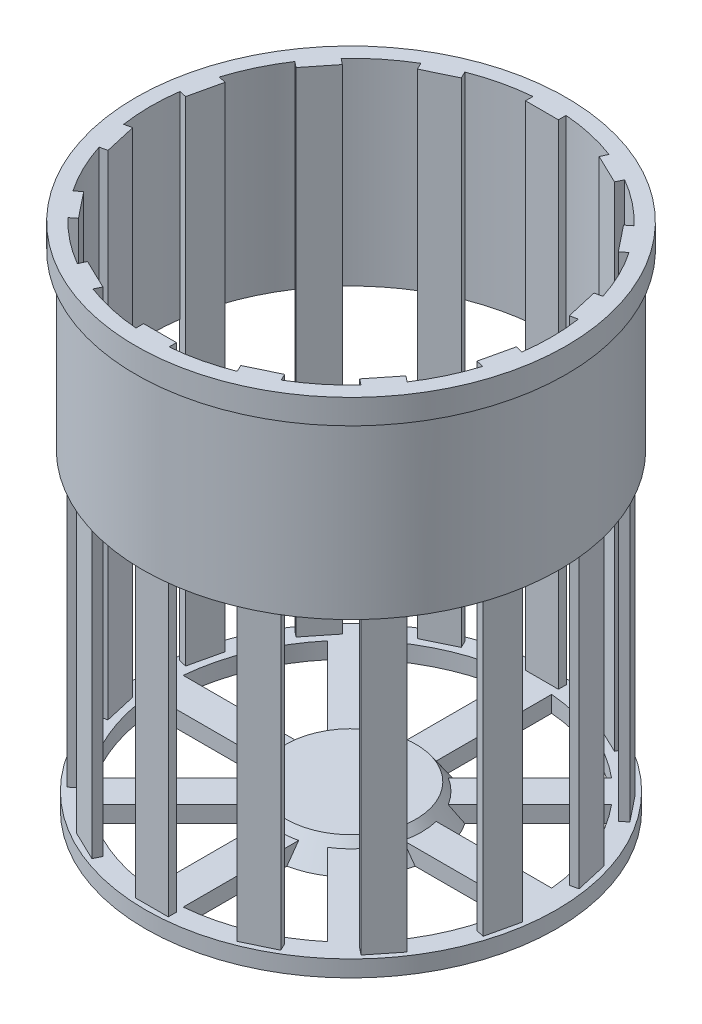
from build123d import *

# Parameters (mm, degrees)
SKETCH_1_R               = 10
EXTRUDE_1_DEPTH          = 3
EXTRUDE_1_TAPER          = 35
SKETCH_2_W               = 4
SKETCH_2_H               = 17
EXTRUDE_2_DEPTH          = 2
PATTERN_CIRCULAR_1_COUNT = 8
SKETCH_3_R               = 25
SKETCH_3_R_2             = 22.5
EXTRUDE_3_DEPTH          = 2
SKETCH_5_W               = 4
SKETCH_5_H               = 1
EXTRUDE_4_DEPTH          = 60
PATTERN_CIRCULAR_2_COUNT = 14
SKETCH_8_R               = 25.353025185
SKETCH_8_R_2             = 24.353025185
EXTRUDE_1_2_DEPTH        = 24
SKETCH_9_R               = 26.182989569
SKETCH_9_R_2             = 25.182989569
EXTRUDE_2_2_DEPTH        = 3


with BuildPart() as part:
    # Эскиз1 → Extrude 1 (new body)
    with BuildSketch(Plane(origin=(0, 0, 0), x_dir=(1, 0, 0), z_dir=(0, 1, 0))):
        Circle(SKETCH_1_R)
    extrude(amount=EXTRUDE_1_DEPTH, taper=EXTRUDE_1_TAPER)

    # Эскиз2 → Extrude 2 (add)
    with BuildSketch(Plane.XZ):
        with Locations((0, 15.5)):
            Rectangle(SKETCH_2_W, SKETCH_2_H)
    extrude_2 = extrude(amount=-EXTRUDE_2_DEPTH)

    # Круговой массив1: Extrude 2 ×8 about axis
    pattern_circular_1_axis = Axis((0, 0, 0), (0, 1, 0))
    for i in range(1, PATTERN_CIRCULAR_1_COUNT):
        add(extrude_2.rotate(pattern_circular_1_axis, i * 360 / PATTERN_CIRCULAR_1_COUNT))

    # Эскиз3 → Бобышка-Вытянуть3 (add)
    with BuildSketch(Plane(origin=(0, 0, 0), x_dir=(1, 0, 0), z_dir=(0, 1, 0))):
        with Locations(Location((0, 0, 0), (0, 0, 270))):
            Circle(SKETCH_3_R)
        Circle(SKETCH_3_R_2, mode=Mode.SUBTRACT)
    extrude(amount=EXTRUDE_3_DEPTH)

    # Эскиз5 → Бобышка-Вытянуть4 (add)
    with BuildSketch(Plane(origin=(0, 2, 0), x_dir=(1, 0, 0), z_dir=(0, 1, 0))):
        with Locations((-0.12233464, 23.853025185)):
            Rectangle(SKETCH_5_W, SKETCH_5_H)
    extrude_4 = extrude(amount=EXTRUDE_4_DEPTH)

    # Круговой массив2: Бобышка-Вытянуть4 ×14 about axis
    pattern_circular_2_axis = Axis((0, 0, 0), (0, 1, 0))
    for i in range(1, PATTERN_CIRCULAR_2_COUNT):
        add(extrude_4.rotate(pattern_circular_2_axis, i * 360 / PATTERN_CIRCULAR_2_COUNT))

    # Эскиз8 → Extrude 1 2 (add)
    with BuildSketch(Plane(origin=(0, 62, 0), x_dir=(1, 0, 0), z_dir=(0, 1, 0))):
        Circle(SKETCH_8_R)
        Circle(SKETCH_8_R_2, mode=Mode.SUBTRACT)
    extrude(amount=-EXTRUDE_1_2_DEPTH)

    # Эскиз9 → Extrude 2 2 (add)
    with BuildSketch(Plane(origin=(0, 62, 0), x_dir=(1, 0, 0), z_dir=(0, 1, 0))):
        Circle(SKETCH_9_R)
        Circle(SKETCH_9_R_2, mode=Mode.SUBTRACT)
    extrude(amount=-EXTRUDE_2_2_DEPTH)


solid = part.part
